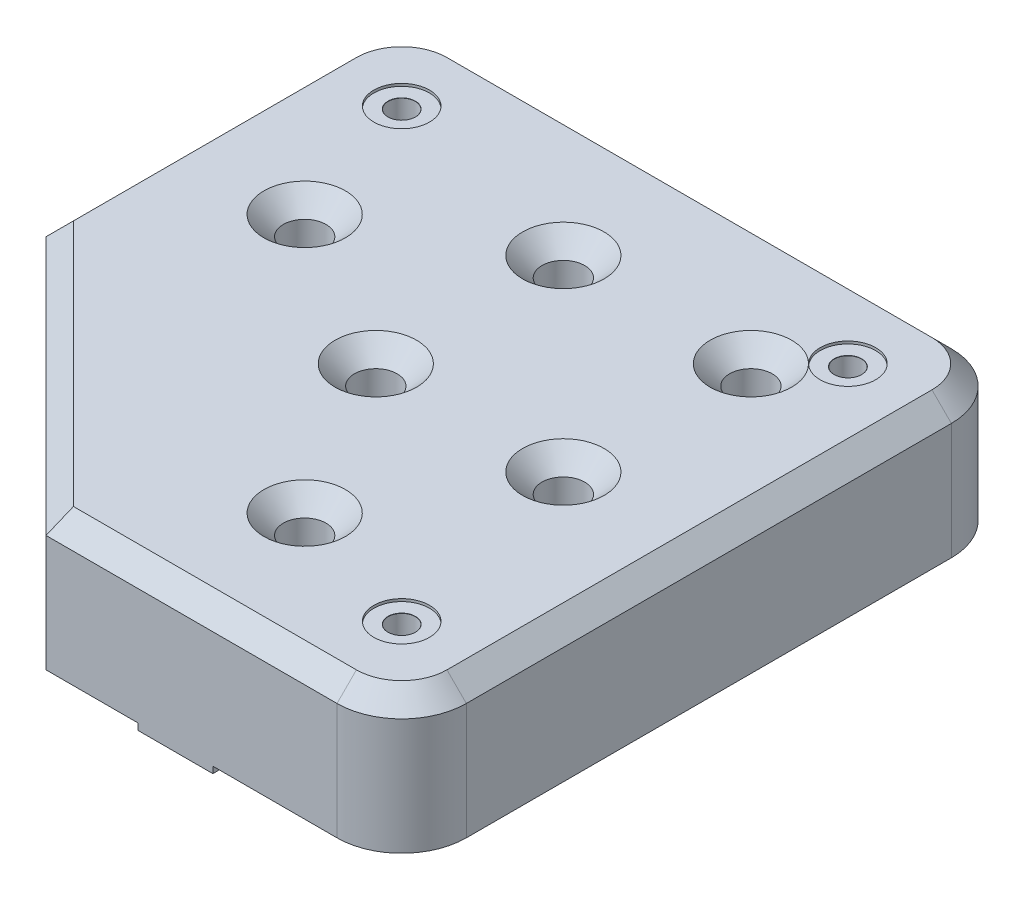
from build123d import *

# Parameters (mm, degrees)
SKETCH_1_W                 = 80
SKETCH_1_H                 = 80
EXTRUDE_314_DEPTH          = 21
EXTRUDE_603_DEPTH          = 21
CUT_EXTRUDE_830_DEPTH      = 81.566742518
SKETCH_3_W                 = 40
SKETCH_3_H                 = 40
CUT_EXTRUDE_1062_DEPTH     = 11.5
FILLET_1_R                 = 2
SKETCH_14_W                = 40
SKETCH_14_H                = 11.6
SKETCH_14_W_2              = 11.6
SKETCH_14_H_2              = 40
EXTRUDE_1761_DEPTH         = 1
HOLE_WIZARD_M6_D           = 6.6
HOLE_WIZARD_M6_CSINK_D     = 12.6
HOLE_WIZARD_M6_CSINK_ANGLE = 90
HOLE_WIZARD_M5_D           = 4.2
HOLE_WIZARD_M5_CSINK_D     = 5.05
HOLE_WIZARD_M5_CSINK_ANGLE = 90
FILLET_2_R                 = 10
CHAMFER_1_SIZE             = 3
SKETCH_15_R                = 4.3
CUT_EXTRUDE_1_DEPTH        = 0.4


with BuildPart() as part:
    # Эскиз1 → Extrude 314 (new body)
    with BuildSketch(Plane(origin=(0, 0, 0), x_dir=(1, 0, 0), z_dir=(0, 1, 0))):
        Rectangle(SKETCH_1_W, SKETCH_1_H)
    extrude(amount=EXTRUDE_314_DEPTH)

    # Эскиз11 → Extrude 603 (add)
    with BuildSketch(Plane(origin=(0, 21, 0), x_dir=(1, 0, 0), z_dir=(0, 1, 0))):
        Polygon((40, -40), (55, -40), (55, 55), (-40, 55), (-40, 40), (40, 40), align=None)
    extrude(amount=-EXTRUDE_603_DEPTH)

    # Эскиз2 → Cut-Extrude 830 (cut, through all)
    with BuildSketch(Plane(origin=(0, 21, 0), x_dir=(1, 0, 0), z_dir=(0, 1, 0))):
        Polygon((-40, -40), (-40, 0), (0, -40), align=None)
    extrude(amount=-CUT_EXTRUDE_830_DEPTH, mode=Mode.SUBTRACT)

    # Эскиз3 → Cut-Extrude 1062 (cut)
    with BuildSketch(Plane.XZ):
        with Locations((20, -20)):
            Rectangle(SKETCH_3_W, SKETCH_3_H)
    extrude(amount=-CUT_EXTRUDE_1062_DEPTH, mode=Mode.SUBTRACT)

    # Скругление1
    fillet_1_edges = [part.edges().sort_by_distance(p)[0] for p in [
        (40, 5.75, 0),
        (40, 5.75, -40),
        (0, 5.75, -40),
        (0, 5.75, 0),
    ]]
    fillet(fillet_1_edges, radius=FILLET_1_R)

    # Эскиз14 → Extrude 1761 (add)
    with BuildSketch(Plane.XZ):
        with Locations((-20, -20)):
            Rectangle(SKETCH_14_W, SKETCH_14_H)
        with Locations((20, 20)):
            Rectangle(SKETCH_14_W_2, SKETCH_14_H_2)
    extrude(amount=EXTRUDE_1761_DEPTH)

    # Крепление-M6 (through all)
    with Locations(Plane(origin=(0, 21, 0), x_dir=(1, 0, 0), z_dir=(0, 1, 0))):
        with Locations((-20, 20), (20, -20), (5.5, 34.5), (34.5, 34.5), (34.5, 5.5), (5.5, 5.5)):
            CounterSinkHole(HOLE_WIZARD_M6_D / 2, HOLE_WIZARD_M6_CSINK_D / 2, counter_sink_angle=HOLE_WIZARD_M6_CSINK_ANGLE)

    # Шкивы-M5 (through all)
    with Locations(Plane(origin=(0, 21, 0), x_dir=(1, 0, 0), z_dir=(0, 1, 0))):
        with Locations((42, 42), (-27, 42), (42, -27)):
            CounterSinkHole(HOLE_WIZARD_M5_D / 2, HOLE_WIZARD_M5_CSINK_D / 2, counter_sink_angle=HOLE_WIZARD_M5_CSINK_ANGLE)

    # Скругление2
    fillet_2_edges = [part.edges().sort_by_distance(p)[0] for p in [
        (-40, 10.5, -55),
        (55, 10.5, -55),
        (55, 10.5, 40),
    ]]
    fillet(fillet_2_edges, radius=FILLET_2_R)

    # Фаска1
    chamfer_1_edges = [part.edges().sort_by_distance(p)[0] for p in [
        (7.5, 21, -55),
        (55, 21, -7.5),
        (-40, 21, -22.5),
        (52.071067812, 21, 37.071067812),
        (52.071067812, 21, -52.071067812),
        (-37.071067812, 21, -52.071067812),
        (22.5, 21, 40),
        (-20, 21, 20),
    ]]
    chamfer(chamfer_1_edges, length=CHAMFER_1_SIZE)

    # Эскиз15 → Вырез-Вытянуть1 (cut)
    with BuildSketch(Plane(origin=(0, 21, 0), x_dir=(1, 0, 0), z_dir=(0, 1, 0))):
        with Locations(Location((42, 42, 0), (0, 0, 270))):
            Circle(SKETCH_15_R)
        with Locations(Location((-27, 42, 0), (0, 0, 270))):
            Circle(SKETCH_15_R)
        with Locations(Location((42, -27, 0), (0, 0, 270))):
            Circle(SKETCH_15_R)
    extrude(amount=-CUT_EXTRUDE_1_DEPTH, mode=Mode.SUBTRACT)


solid = part.part
